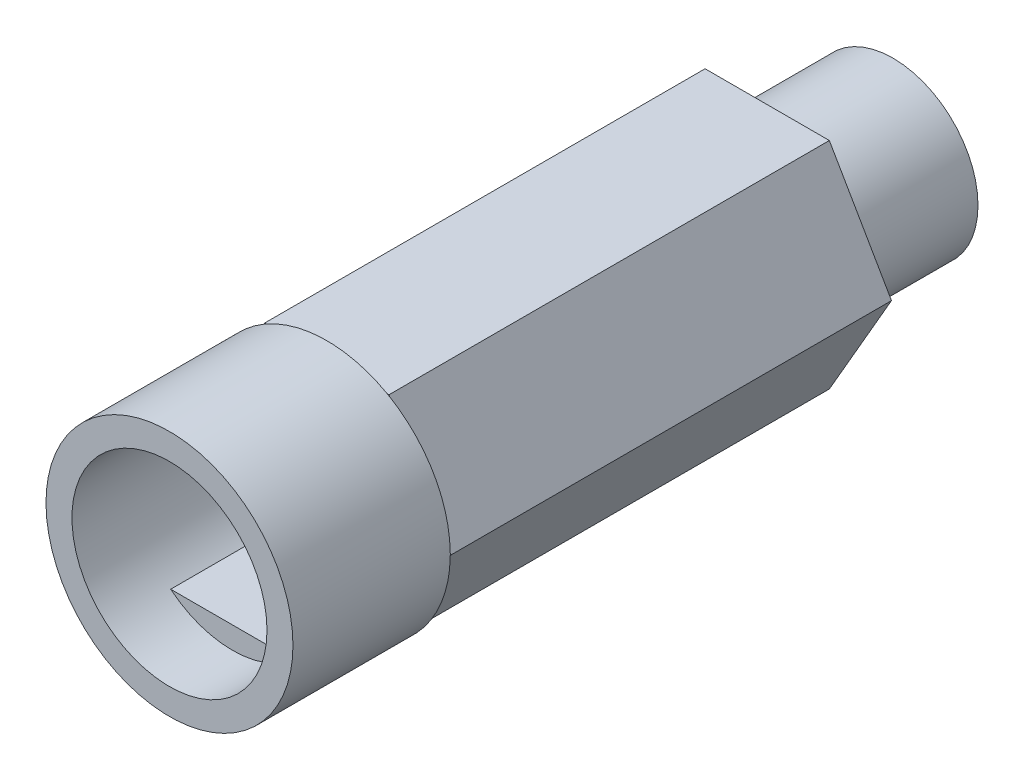
from build123d import *

# Parameters (mm, degrees)
BOSS_EXTRUDE1_DEPTH = 14
SKETCH2_R           = 3.925
BOSS_EXTRUDE2_DEPTH = 5
SKETCH3_R           = 2.7
BOSS_EXTRUDE3_DEPTH = 4
CUT_EXTRUDE1_DEPTH  = 16
SKETCH5_R           = 3.1
CUT_EXTRUDE2_DEPTH  = 2


with BuildPart() as part:
    # Sketch1 → Boss-Extrude1 (new body)
    with BuildSketch(Plane.XY):
        Polygon((3.95, 0), (1.975, 3.420800345), (-1.975, 3.420800345), (-3.95, 0), (-1.975, -3.420800345), (1.975, -3.420800345), align=None)
    extrude(amount=BOSS_EXTRUDE1_DEPTH)

    # Sketch2 → Boss-Extrude2 (add)
    with BuildSketch(Plane.XY.offset(14)):
        with Locations(Location((0, 0, 0), (0, 0, 180.63826759))):
            Circle(SKETCH2_R)
    extrude(amount=BOSS_EXTRUDE2_DEPTH)

    # Sketch3 → Boss-Extrude3 (add)
    with BuildSketch(Plane(origin=(0, 0, 0), x_dir=(-1, 0, 0), z_dir=(0, 0, -1))):
        Circle(SKETCH3_R)
    extrude(amount=BOSS_EXTRUDE3_DEPTH)

    # Sketch4 → Cut-Extrude1 (cut)
    with BuildSketch(Plane.XY.offset(19)):
        with BuildLine():
            ThreePointArc((3.1, 0), (-1.328036289, 2.801128275), (-1.962141687, -2.4))
            Line((-1.962141687, -2.4), (1.962141687, -2.4))
            ThreePointArc((1.962141687, -2.4), (2.801128275, -1.328036289), (3.1, 0))
        make_face()
    extrude(amount=-CUT_EXTRUDE1_DEPTH, mode=Mode.SUBTRACT)

    # Sketch5 → Cut-Extrude2 (cut)
    with BuildSketch(Plane.XY.offset(19)):
        Circle(SKETCH5_R)
    extrude(amount=-CUT_EXTRUDE2_DEPTH, mode=Mode.SUBTRACT)


solid = part.part
